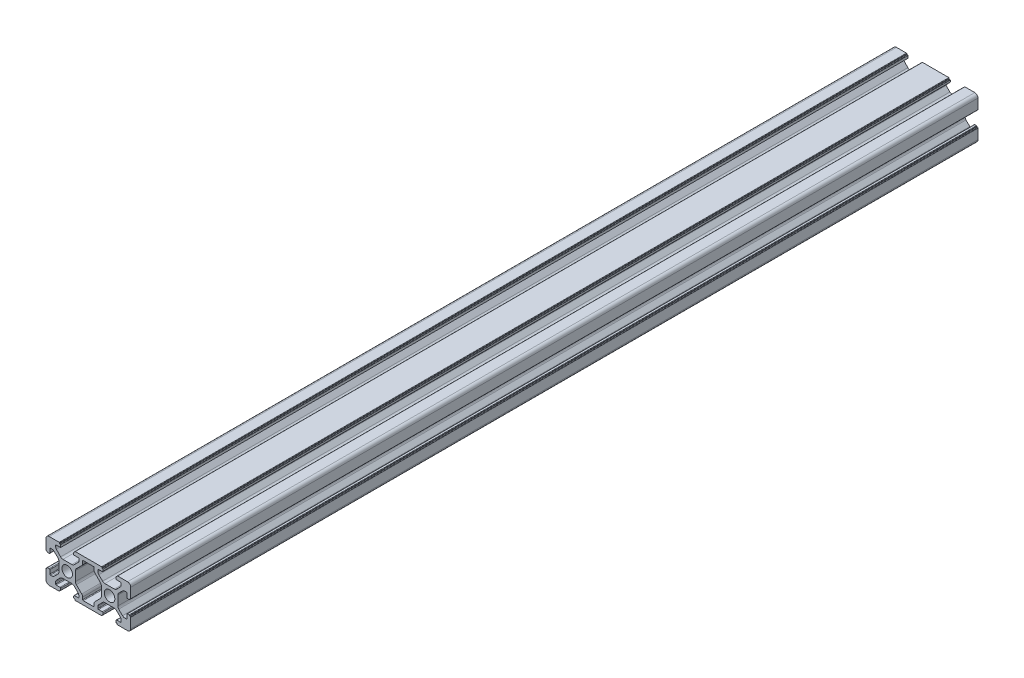
from build123d import *

# Parameters (mm, degrees)
SKETCH1_R           = 2.5
BOSS_EXTRUDE2_DEPTH = 400


with BuildPart() as part:
    # Sketch1 → Boss-Extrude2 (new body)
    with BuildSketch(Plane.XY):
        with BuildLine():
            Line((1.5, 0), (6.2, 0))
            ThreePointArc((6.2, 0), (6.341421356, 0.058578644), (6.4, 0.2))
            Line((6.4, 0.2), (6.4, 0.3))
            ThreePointArc((6.4, 0.3), (6.458578644, 0.441421356), (6.6, 0.5))
            Line((6.6, 0.5), (6.7, 0.5))
            ThreePointArc((6.7, 0.5), (6.841421356, 0.558578644), (6.9, 0.7))
            Line((6.9, 0.7), (6.9, 1.5))
            ThreePointArc((6.9, 1.5), (6.812132034, 1.712132034), (6.6, 1.8))
            Line((6.6, 1.8), (4.8, 1.8))
            ThreePointArc((4.8, 1.8), (4.587867966, 1.887867966), (4.5, 2.1))
            Line((4.5, 2.1), (4.5, 2.818019485))
            ThreePointArc((4.5, 2.818019485), (4.614180701, 3.392044633), (4.939339828, 3.878679656))
            Line((4.939339828, 3.878679656), (6.721320344, 5.660660172))
            ThreePointArc((6.721320344, 5.660660172), (7.207955367, 5.985819299), (7.781980515, 6.1))
            Line((7.781980515, 6.1), (12.218019485, 6.1))
            ThreePointArc((12.218019485, 6.1), (12.792044633, 5.985819299), (13.278679656, 5.660660172))
            Line((13.278679656, 5.660660172), (15.060660172, 3.878679656))
            ThreePointArc((15.060660172, 3.878679656), (15.385819299, 3.392044633), (15.5, 2.818019485))
            Line((15.5, 2.818019485), (15.5, 2.1))
            ThreePointArc((15.5, 2.1), (15.412132034, 1.887867966), (15.2, 1.8))
            Line((15.2, 1.8), (13.4, 1.8))
            ThreePointArc((13.4, 1.8), (13.187867966, 1.712132034), (13.1, 1.5))
            Line((13.1, 1.5), (13.1, 0.7))
            ThreePointArc((13.1, 0.7), (13.158578644, 0.558578644), (13.3, 0.5))
            Line((13.3, 0.5), (13.4, 0.5))
            ThreePointArc((13.4, 0.5), (13.541421356, 0.441421356), (13.6, 0.3))
            Line((13.6, 0.3), (13.6, 0.2))
            ThreePointArc((13.6, 0.2), (13.658578644, 0.058578644), (13.8, 0))
            Line((13.8, 0), (26.2, 0))
            ThreePointArc((26.2, 0), (26.341421356, 0.058578644), (26.4, 0.2))
            Line((26.4, 0.2), (26.4, 0.3))
            ThreePointArc((26.4, 0.3), (26.458578644, 0.441421356), (26.6, 0.5))
            Line((26.6, 0.5), (26.7, 0.5))
            ThreePointArc((26.7, 0.5), (26.841421356, 0.558578644), (26.9, 0.7))
            Line((26.9, 0.7), (26.9, 1.5))
            ThreePointArc((26.9, 1.5), (26.812132034, 1.712132034), (26.6, 1.8))
            Line((26.6, 1.8), (24.8, 1.8))
            ThreePointArc((24.8, 1.8), (24.587867966, 1.887867966), (24.5, 2.1))
            Line((24.5, 2.1), (24.5, 2.818019485))
            ThreePointArc((24.5, 2.818019485), (24.614180701, 3.392044633), (24.939339828, 3.878679656))
            Line((24.939339828, 3.878679656), (26.721320344, 5.660660172))
            ThreePointArc((26.721320344, 5.660660172), (27.207955367, 5.985819299), (27.781980515, 6.1))
            Line((27.781980515, 6.1), (32.218019485, 6.1))
            ThreePointArc((32.218019485, 6.1), (32.792044633, 5.985819299), (33.278679656, 5.660660172))
            Line((33.278679656, 5.660660172), (35.060660172, 3.878679656))
            ThreePointArc((35.060660172, 3.878679656), (35.385819299, 3.392044633), (35.5, 2.818019485))
            Line((35.5, 2.818019485), (35.5, 2.1))
            ThreePointArc((35.5, 2.1), (35.412132034, 1.887867966), (35.2, 1.8))
            Line((35.2, 1.8), (33.4, 1.8))
            ThreePointArc((33.4, 1.8), (33.187867966, 1.712132034), (33.1, 1.5))
            Line((33.1, 1.5), (33.1, 0.7))
            ThreePointArc((33.1, 0.7), (33.158578644, 0.558578644), (33.3, 0.5))
            Line((33.3, 0.5), (33.4, 0.5))
            ThreePointArc((33.4, 0.5), (33.541421356, 0.441421356), (33.6, 0.3))
            Line((33.6, 0.3), (33.6, 0.2))
            ThreePointArc((33.6, 0.2), (33.658578644, 0.058578644), (33.8, 0))
            Line((33.8, 0), (38.5, 0))
            ThreePointArc((38.5, 0), (39.560660172, 0.439339828), (40, 1.5))
            Line((40, 1.5), (40, 6.2))
            ThreePointArc((40, 6.2), (39.941421356, 6.341421356), (39.8, 6.4))
            Line((39.8, 6.4), (39.7, 6.4))
            ThreePointArc((39.7, 6.4), (39.558578644, 6.458578644), (39.5, 6.6))
            Line((39.5, 6.6), (39.5, 6.7))
            ThreePointArc((39.5, 6.7), (39.441421356, 6.841421356), (39.3, 6.9))
            Line((39.3, 6.9), (38.5, 6.9))
            ThreePointArc((38.5, 6.9), (38.287867966, 6.812132034), (38.2, 6.6))
            Line((38.2, 6.6), (38.2, 4.8))
            ThreePointArc((38.2, 4.8), (38.112132034, 4.587867966), (37.9, 4.5))
            Line((37.9, 4.5), (37.181980515, 4.5))
            ThreePointArc((37.181980515, 4.5), (36.607955367, 4.614180701), (36.121320344, 4.939339828))
            Line((36.121320344, 4.939339828), (34.339339828, 6.721320344))
            ThreePointArc((34.339339828, 6.721320344), (34.014180701, 7.207955367), (33.9, 7.781980515))
            Line((33.9, 7.781980515), (33.9, 12.218019485))
            ThreePointArc((33.9, 12.218019485), (34.014180701, 12.792044633), (34.339339828, 13.278679656))
            Line((34.339339828, 13.278679656), (36.121320344, 15.060660172))
            ThreePointArc((36.121320344, 15.060660172), (36.607955367, 15.385819299), (37.181980515, 15.5))
            Line((37.181980515, 15.5), (37.9, 15.5))
            ThreePointArc((37.9, 15.5), (38.112132034, 15.412132034), (38.2, 15.2))
            Line((38.2, 15.2), (38.2, 13.4))
            ThreePointArc((38.2, 13.4), (38.287867966, 13.187867966), (38.5, 13.1))
            Line((38.5, 13.1), (39.3, 13.1))
            ThreePointArc((39.3, 13.1), (39.441421356, 13.158578644), (39.5, 13.3))
            Line((39.5, 13.3), (39.5, 13.4))
            ThreePointArc((39.5, 13.4), (39.558578644, 13.541421356), (39.7, 13.6))
            Line((39.7, 13.6), (39.8, 13.6))
            ThreePointArc((39.8, 13.6), (39.941421356, 13.658578644), (40, 13.8))
            Line((40, 13.8), (40, 18.5))
            ThreePointArc((40, 18.5), (39.560660172, 19.560660172), (38.5, 20))
            Line((38.5, 20), (33.8, 20))
            ThreePointArc((33.8, 20), (33.658578644, 19.941421356), (33.6, 19.8))
            Line((33.6, 19.8), (33.6, 19.7))
            ThreePointArc((33.6, 19.7), (33.541421356, 19.558578644), (33.4, 19.5))
            Line((33.4, 19.5), (33.3, 19.5))
            ThreePointArc((33.3, 19.5), (33.158578644, 19.441421356), (33.1, 19.3))
            Line((33.1, 19.3), (33.1, 18.5))
            ThreePointArc((33.1, 18.5), (33.187867966, 18.287867966), (33.4, 18.2))
            Line((33.4, 18.2), (35.2, 18.2))
            ThreePointArc((35.2, 18.2), (35.412132034, 18.112132034), (35.5, 17.9))
            Line((35.5, 17.9), (35.5, 17.181980515))
            ThreePointArc((35.5, 17.181980515), (35.385819299, 16.607955367), (35.060660172, 16.121320344))
            Line((35.060660172, 16.121320344), (33.278679656, 14.339339828))
            ThreePointArc((33.278679656, 14.339339828), (32.792044633, 14.014180701), (32.218019485, 13.9))
            Line((32.218019485, 13.9), (27.781980515, 13.9))
            ThreePointArc((27.781980515, 13.9), (27.207955367, 14.014180701), (26.721320344, 14.339339828))
            Line((26.721320344, 14.339339828), (24.939339828, 16.121320344))
            ThreePointArc((24.939339828, 16.121320344), (24.614180701, 16.607955367), (24.5, 17.181980515))
            Line((24.5, 17.181980515), (24.5, 17.9))
            ThreePointArc((24.5, 17.9), (24.587867966, 18.112132034), (24.8, 18.2))
            Line((24.8, 18.2), (26.6, 18.2))
            ThreePointArc((26.6, 18.2), (26.812132034, 18.287867966), (26.9, 18.5))
            Line((26.9, 18.5), (26.9, 19.3))
            ThreePointArc((26.9, 19.3), (26.841421356, 19.441421356), (26.7, 19.5))
            Line((26.7, 19.5), (26.6, 19.5))
            ThreePointArc((26.6, 19.5), (26.458578644, 19.558578644), (26.4, 19.7))
            Line((26.4, 19.7), (26.4, 19.8))
            ThreePointArc((26.4, 19.8), (26.341421356, 19.941421356), (26.2, 20))
            Line((26.2, 20), (13.8, 20))
            ThreePointArc((13.8, 20), (13.658578644, 19.941421356), (13.6, 19.8))
            Line((13.6, 19.8), (13.6, 19.7))
            ThreePointArc((13.6, 19.7), (13.541421356, 19.558578644), (13.4, 19.5))
            Line((13.4, 19.5), (13.3, 19.5))
            ThreePointArc((13.3, 19.5), (13.158578644, 19.441421356), (13.1, 19.3))
            Line((13.1, 19.3), (13.1, 18.2))
            Line((13.1, 18.2), (15.3, 18.2))
            ThreePointArc((15.3, 18.2), (15.512132034, 18.112132034), (15.6, 17.9))
            Line((15.6, 17.9), (15.6, 17.281980515))
            ThreePointArc((15.6, 17.281980515), (15.485819299, 16.707955367), (15.160660172, 16.221320344))
            Line((15.160660172, 16.221320344), (13.278679656, 14.339339828))
            ThreePointArc((13.278679656, 14.339339828), (12.792044633, 14.014180701), (12.218019485, 13.9))
            Line((12.218019485, 13.9), (7.986375635, 13.9))
            ThreePointArc((7.986375635, 13.9), (7.393381044, 14.022191082), (6.896997987, 14.36885678))
            Line((6.896997987, 14.36885678), (4.910622352, 16.467414163))
            ThreePointArc((4.910622352, 16.467414163), (4.606431474, 16.943609851), (4.5, 17.498557383))
            Line((4.5, 17.498557383), (4.5, 17.9))
            ThreePointArc((4.5, 17.9), (4.587867966, 18.112132034), (4.8, 18.2))
            Line((4.8, 18.2), (6.9, 18.2))
            Line((6.9, 18.2), (6.9, 19.3))
            ThreePointArc((6.9, 19.3), (6.841421356, 19.441421356), (6.7, 19.5))
            Line((6.7, 19.5), (6.6, 19.5))
            ThreePointArc((6.6, 19.5), (6.458578644, 19.558578644), (6.4, 19.7))
            Line((6.4, 19.7), (6.4, 19.8))
            ThreePointArc((6.4, 19.8), (6.341421356, 19.941421356), (6.2, 20))
            Line((6.2, 20), (1.5, 20))
            ThreePointArc((1.5, 20), (0.439339828, 19.560660172), (0, 18.5))
            Line((0, 18.5), (0, 13.8))
            ThreePointArc((0, 13.8), (0.058578644, 13.658578644), (0.2, 13.6))
            Line((0.2, 13.6), (0.3, 13.6))
            ThreePointArc((0.3, 13.6), (0.441421356, 13.541421356), (0.5, 13.4))
            Line((0.5, 13.4), (0.5, 13.3))
            ThreePointArc((0.5, 13.3), (0.558578644, 13.158578644), (0.7, 13.1))
            Line((0.7, 13.1), (1.5, 13.1))
            ThreePointArc((1.5, 13.1), (1.712132034, 13.187867966), (1.8, 13.4))
            Line((1.8, 13.4), (1.8, 15.2))
            ThreePointArc((1.8, 15.2), (1.887867966, 15.412132034), (2.1, 15.5))
            Line((2.1, 15.5), (2.818019485, 15.5))
            ThreePointArc((2.818019485, 15.5), (3.392044633, 15.385819299), (3.878679656, 15.060660172))
            Line((3.878679656, 15.060660172), (5.660660172, 13.278679656))
            ThreePointArc((5.660660172, 13.278679656), (5.985819299, 12.792044633), (6.1, 12.218019485))
            Line((6.1, 12.218019485), (6.1, 7.781980515))
            ThreePointArc((6.1, 7.781980515), (5.985819299, 7.207955367), (5.660660172, 6.721320344))
            Line((5.660660172, 6.721320344), (3.878679656, 4.939339828))
            ThreePointArc((3.878679656, 4.939339828), (3.392044633, 4.614180701), (2.818019485, 4.5))
            Line((2.818019485, 4.5), (2.1, 4.5))
            ThreePointArc((2.1, 4.5), (1.887867966, 4.587867966), (1.8, 4.8))
            Line((1.8, 4.8), (1.8, 6.6))
            ThreePointArc((1.8, 6.6), (1.712132034, 6.812132034), (1.5, 6.9))
            Line((1.5, 6.9), (0.7, 6.9))
            ThreePointArc((0.7, 6.9), (0.558578644, 6.841421356), (0.5, 6.7))
            Line((0.5, 6.7), (0.5, 6.6))
            ThreePointArc((0.5, 6.6), (0.441421356, 6.458578644), (0.3, 6.4))
            Line((0.3, 6.4), (0.2, 6.4))
            ThreePointArc((0.2, 6.4), (0.058578644, 6.341421356), (0, 6.2))
            Line((0, 6.2), (0, 1.5))
            ThreePointArc((0, 1.5), (0.439339828, 0.439339828), (1.5, 0))
        make_face()
        with Locations((10, 10)):
            Circle(SKETCH1_R, mode=Mode.SUBTRACT)
        with Locations((30, 10)):
            Circle(SKETCH1_R, mode=Mode.SUBTRACT)
        with BuildLine():
            Line((17.6, 1.8), (22.4, 1.8))
            ThreePointArc((22.4, 1.8), (22.612132034, 1.887867966), (22.7, 2.1))
            Line((22.7, 2.1), (22.7, 3.139339828))
            ThreePointArc((22.7, 3.139339828), (22.814180701, 3.713364977), (23.139339828, 4.2))
            Line((23.139339828, 4.2), (25.660660172, 6.721320344))
            ThreePointArc((25.660660172, 6.721320344), (25.985819299, 7.207955367), (26.1, 7.781980515))
            Line((26.1, 7.781980515), (26.1, 12.218019485))
            ThreePointArc((26.1, 12.218019485), (25.985819299, 12.792044633), (25.660660172, 13.278679656))
            Line((25.660660172, 13.278679656), (23.139339828, 15.8))
            ThreePointArc((23.139339828, 15.8), (22.814180701, 16.286635023), (22.7, 16.860660172))
            Line((22.7, 16.860660172), (22.7, 17.9))
            ThreePointArc((22.7, 17.9), (22.612132034, 18.112132034), (22.4, 18.2))
            Line((22.4, 18.2), (17.6, 18.2))
            ThreePointArc((17.6, 18.2), (17.387867966, 18.112132034), (17.3, 17.9))
            Line((17.3, 17.9), (17.3, 16.860660172))
            ThreePointArc((17.3, 16.860660172), (17.185819299, 16.286635023), (16.860660172, 15.8))
            Line((16.860660172, 15.8), (14.339339828, 13.278679656))
            ThreePointArc((14.339339828, 13.278679656), (14.014180701, 12.792044633), (13.9, 12.218019485))
            Line((13.9, 12.218019485), (13.9, 7.781980515))
            ThreePointArc((13.9, 7.781980515), (14.014180701, 7.207955367), (14.339339828, 6.721320344))
            Line((14.339339828, 6.721320344), (16.860660172, 4.2))
            ThreePointArc((16.860660172, 4.2), (17.185819299, 3.713364977), (17.3, 3.139339828))
            Line((17.3, 3.139339828), (17.3, 2.1))
            ThreePointArc((17.3, 2.1), (17.387867966, 1.887867966), (17.6, 1.8))
        make_face(mode=Mode.SUBTRACT)
    extrude(amount=BOSS_EXTRUDE2_DEPTH)


solid = part.part
